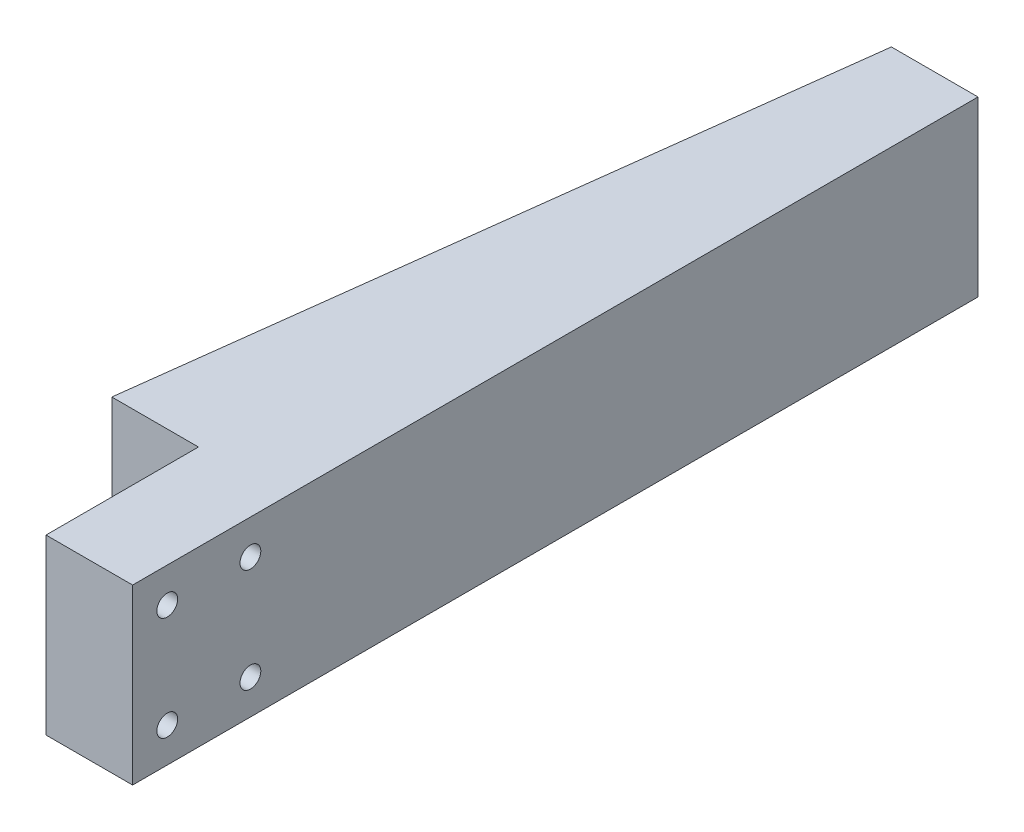
from build123d import *

# Parameters (mm, degrees)
SKETCH1_W           = 122
SKETCH1_H           = 25
SKETCH1_R           = 1.5
BOSS_EXTRUDE1_DEPTH = 12.5
BOSS_EXTRUDE2_DEPTH = 25


with BuildPart() as part:
    # Sketch1 → Boss-Extrude1 (new body)
    with BuildSketch(Plane(origin=(0, 0, 0), x_dir=(0, 0, -1), z_dir=(1, 0, 0))):
        with Locations((61, 12.5)):
            Rectangle(SKETCH1_W, SKETCH1_H)
        with Locations((5, 20)):
            Circle(SKETCH1_R, mode=Mode.SUBTRACT)
        with Locations((17, 20)):
            Circle(SKETCH1_R, mode=Mode.SUBTRACT)
        with Locations((17, 5)):
            Circle(SKETCH1_R, mode=Mode.SUBTRACT)
        with Locations((5, 5)):
            Circle(SKETCH1_R, mode=Mode.SUBTRACT)
    extrude(amount=-BOSS_EXTRUDE1_DEPTH)

    # Sketch2 → Boss-Extrude2 (add)
    with BuildSketch(Plane(origin=(0, 25, 0), x_dir=(1, 0, 0), z_dir=(0, 1, 0))):
        Polygon((-12.5, 122), (-25, 22), (-12.5, 22), align=None)
    extrude(amount=-BOSS_EXTRUDE2_DEPTH)


solid = part.part
